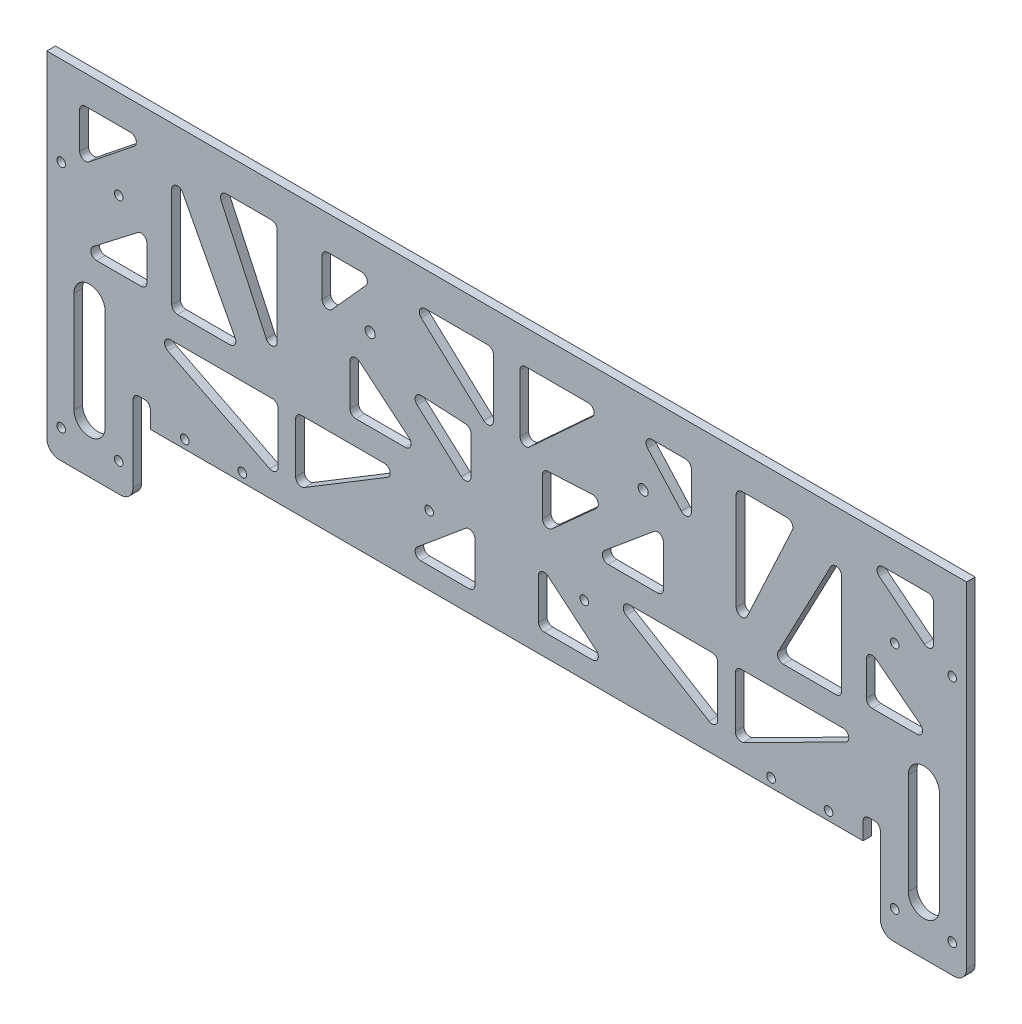
from build123d import *

# Parameters (mm, degrees)
SKETCH_1_W          = 320
SKETCH_1_H          = 91
EXTRUDE_1_DEPTH     = 1.5
SKETCH_2_W          = 30
SKETCH_2_H          = 5
SKETCH_2_W_2        = 248
EXTRUDE_3_DEPTH     = 3
SKETCH_2_4_W        = 6
SKETCH_2_4_H        = 3
CUT_EXTRUDE_1_DEPTH = 3
FILLET_1_R          = 2
SKETCH_3_R          = 1.5
CUT_EXTRUDE_2_DEPTH = 10
SKETCH_4_R          = 1.5
CUT_EXTRUDE_3_DEPTH = 10
EXTRUDE_5_DEPTH     = 3
SKETCH_6_R          = 1.5
CUT_EXTRUDE_4_DEPTH = 10
SKETCH_7_R          = 1.5
CUT_EXTRUDE_5_DEPTH = 10
CUT_EXTRUDE_6_DEPTH = 6.47
CUT_EXTRUDE_7_DEPTH = 10


with BuildPart() as part:
    # 草图1 → 凸台-拉伸1 (new, symmetric)
    with BuildSketch(Plane.XY):
        Rectangle(SKETCH_1_W, SKETCH_1_H)
    extrude(amount=EXTRUDE_1_DEPTH, both=True)

    # 草图2 → 凸台-拉伸3 (add)
    with BuildSketch(Plane.XY.offset(1.5)):
        with Locations((-145, -48)):
            Rectangle(SKETCH_2_W, SKETCH_2_H)
        with Locations((0, -48)):
            Rectangle(SKETCH_2_W_2, SKETCH_2_H)
        with Locations((145, -48)):
            Rectangle(SKETCH_2_W, SKETCH_2_H)
    extrude(amount=-EXTRUDE_3_DEPTH)

    # 草图2<4> → 切除-拉伸1 (cut)
    with BuildSketch(Plane.XY.offset(1.5)):
        with Locations((-127, -44)):
            Rectangle(SKETCH_2_4_W, SKETCH_2_4_H)
        with Locations((127, -44)):
            Rectangle(SKETCH_2_4_W, SKETCH_2_4_H)
    extrude(amount=-CUT_EXTRUDE_1_DEPTH, mode=Mode.SUBTRACT)

    # 圆角1
    fillet_1_edges = [part.edges().sort_by_distance(p)[0] for p in [
        (-124, -42.5, 0),
        (-130, -42.5, 0),
        (124, -42.5, 0),
        (130, -42.5, 0),
    ]]
    fillet(fillet_1_edges, radius=FILLET_1_R)

    # 草图3 → 切除-拉伸2 (cut)
    with BuildSketch(Plane.XY.offset(1.5)):
        with Locations((-91.985927306, -47.5)):
            Circle(SKETCH_3_R)
        with Locations((-111.985927306, -47.5)):
            Circle(SKETCH_3_R)
    cut_extrude_2 = extrude(amount=-CUT_EXTRUDE_2_DEPTH, mode=Mode.SUBTRACT)

    # 镜向1: 切除-拉伸2 across plane
    add(cut_extrude_2.mirror(Plane(origin=(0, 0, 0), x_dir=(0, 0, 1), z_dir=(1, 0, 0))), mode=Mode.SUBTRACT)

    # 草图4 → 切除-拉伸3 (cut)
    with BuildSketch(Plane.XY.offset(1.5)):
        with Locations((-135, 14.5)):
            Circle(SKETCH_4_R)
        with Locations((-155, 14.5)):
            Circle(SKETCH_4_R)
    cut_extrude_3 = extrude(amount=-CUT_EXTRUDE_3_DEPTH, mode=Mode.SUBTRACT)

    # 镜向2: 切除-拉伸3 across plane
    add(cut_extrude_3.mirror(Plane(origin=(0, 0, 0), x_dir=(0, 0, 1), z_dir=(1, 0, 0))), mode=Mode.SUBTRACT)

    # 草图5 → 凸台-拉伸5 (add)
    with BuildSketch(Plane(origin=(0, 0, -1.5), x_dir=(-1, 0, 0), z_dir=(0, 0, -1))):
        with BuildLine():
            Line((134.369849688, -75.5), (155.630150312, -75.5))
            ThreePointArc((155.630150312, -75.5), (158.720100659, -74.220100659), (160, -71.130150312))
            Line((160, -71.130150312), (160, -50.5))
            Line((160, -50.5), (130, -50.5))
            Line((130, -50.5), (130, -71.130150312))
            ThreePointArc((130, -71.130150312), (131.279899341, -74.220100659), (134.369849688, -75.5))
        make_face()
        with BuildLine():
            Line((-155.630150312, -75.5), (-134.369849688, -75.5))
            ThreePointArc((-134.369849688, -75.5), (-131.279899341, -74.220100659), (-130, -71.130150312))
            Line((-130, -71.130150312), (-130, -50.5))
            Line((-130, -50.5), (-160, -50.5))
            Line((-160, -50.5), (-160, -71.130150312))
            ThreePointArc((-160, -71.130150312), (-158.720100659, -74.220100659), (-155.630150312, -75.5))
        make_face()
    extrude(amount=-EXTRUDE_5_DEPTH)

    # 草图6 → 切除-拉伸4 (cut)
    with BuildSketch(Plane(origin=(0, 0, -1.5), x_dir=(-1, 0, 0), z_dir=(0, 0, -1))):
        with Locations((-155, -65.5)):
            Circle(SKETCH_6_R)
        with Locations((-135, -65.5)):
            Circle(SKETCH_6_R)
        with Locations((135, -65.5)):
            Circle(SKETCH_6_R)
        with Locations((155, -65.5)):
            Circle(SKETCH_6_R)
    extrude(amount=-CUT_EXTRUDE_4_DEPTH, mode=Mode.SUBTRACT)

    # 草图7 → 切除-拉伸5 (cut)
    with BuildSketch(Plane(origin=(0, 0, -1.5), x_dir=(-1, 0, 0), z_dir=(0, 0, -1))):
        with Locations((-27, -26.5)):
            Circle(SKETCH_7_R)
        with Locations(Location((27, -26.5, 0), (0, 0, 180))):
            Circle(SKETCH_7_R)
    extrude(amount=-CUT_EXTRUDE_5_DEPTH, mode=Mode.SUBTRACT)

    # 草图8 → 切除-拉伸6 (cut)
    with BuildSketch(Plane(origin=(0, 0, -1.5), x_dir=(-1, 0, 0), z_dir=(0, 0, -1))):
        with BuildLine():
            ThreePointArc((47.5, 18.75), (45.75, 17), (47.5, 15.25))
            ThreePointArc((47.5, 15.25), (49.25, 17), (47.5, 18.75))
        make_face()
        with BuildLine():
            ThreePointArc((-47.5, 15.25), (-45.75, 17), (-47.5, 18.75))
            ThreePointArc((-47.5, 18.75), (-49.25, 17), (-47.5, 15.25))
        make_face()
    extrude(amount=-CUT_EXTRUDE_6_DEPTH, mode=Mode.SUBTRACT)

    # 草图9 → 切除-拉伸7 (cut)
    with BuildSketch(Plane(origin=(0, 0, -1.5), x_dir=(-1, 0, 0), z_dir=(0, 0, -1))):
        with BuildLine():
            Line((-146.571084673, 35.554762953), (-130.871700622, 35.554762953))
            ThreePointArc((-130.871700622, 35.554762953), (-128.984443984, 34.216776836), (-129.622310527, 31.993025334))
            Line((-129.622310527, 31.993025334), (-145.321694578, 19.433518093))
            ThreePointArc((-145.321694578, 19.433518093), (-147.437462134, 19.19264924), (-148.571084673, 20.995255712))
            Line((-148.571084673, 20.995255712), (-148.571084673, 33.554762953))
            ThreePointArc((-148.571084673, 33.554762953), (-147.985298235, 34.968976515), (-146.571084673, 35.554762953))
        make_face()
        with BuildLine():
            Line((-128.393628192, 6.602606323), (-143.939011658, -5.41906906))
            ThreePointArc((-143.939011658, -5.41906906), (-144.608168342, -7.647623246), (-142.715521969, -9.001179354))
            Line((-142.715521969, -9.001179354), (-127.170138504, -9.001179354))
            ThreePointArc((-127.170138504, -9.001179354), (-125.755924941, -8.415392916), (-125.170138504, -7.001179354))
            Line((-125.170138504, -7.001179354), (-125.170138504, 5.020496029))
            ThreePointArc((-125.170138504, 5.020496029), (-126.288940279, 6.815903974), (-128.393628192, 6.602606323))
        make_face()
        with BuildLine():
            Line((-116.54580622, 25.591570419), (-116.54580622, -9.162371518))
            ThreePointArc((-116.54580622, -9.162371518), (-115.960019782, -10.57658508), (-114.54580622, -11.162371518))
            Line((-114.54580622, -11.162371518), (-96.246357519, -11.162371518))
            ThreePointArc((-96.246357519, -11.162371518), (-94.534105239, -10.195905324), (-94.476686903, -8.230563646))
            Line((-94.476686903, -8.230563646), (-112.776135604, 26.52337829))
            ThreePointArc((-112.776135604, 26.52337829), (-115.025732656, 27.53313438), (-116.54580622, 25.591570419))
        make_face()
        with BuildLine():
            Line((-117.928170429, -23.803173571), (-82.444486766, -41.609211763))
            ThreePointArc((-82.444486766, -41.609211763), (-80.497241641, -41.523714393), (-79.547473298, -39.821652858))
            Line((-79.547473298, -39.821652858), (-79.547473298, -22.015614666))
            ThreePointArc((-79.547473298, -22.015614666), (-80.133259735, -20.601401103), (-81.547473298, -20.015614666))
            Line((-81.547473298, -20.015614666), (-117.031156962, -20.015614666))
            ThreePointArc((-117.031156962, -20.015614666), (-118.977322141, -21.554701339), (-117.928170429, -23.803173571))
        make_face()
        with BuildLine():
            Line((-97.576679079, 33.682660292), (-81.852610734, 33.682660292))
            ThreePointArc((-81.852610734, 33.682660292), (-80.438397171, 33.096873854), (-79.852610734, 31.682660292))
            Line((-79.852610734, 31.682660292), (-79.852610734, -2.182107418))
            ThreePointArc((-79.852610734, -2.182107418), (-81.421327301, -4.135052528), (-83.666605335, -3.024380288))
            Line((-83.666605335, -3.024380288), (-99.39067368, 30.840387422))
            ThreePointArc((-99.39067368, 30.840387422), (-99.262583249, 32.758637583), (-97.576679079, 33.682660292))
        make_face()
        with BuildLine():
            Line((-139.72162397, -22.770668499), (-139.72162397, -57.911176268))
            ThreePointArc((-139.72162397, -57.911176268), (-145.144541836, -63.334094134), (-150.567459701, -57.911176268))
            Line((-150.567459701, -57.911176268), (-150.567459701, -22.770668499))
            ThreePointArc((-150.567459701, -22.770668499), (-145.144541836, -17.347750634), (-139.72162397, -22.770668499))
        make_face()
        with BuildLine():
            Line((-73.425907587, -22.015614666), (-73.425907587, -39.51238657))
            ThreePointArc((-73.425907587, -39.51238657), (-72.40747476, -41.254949592), (-70.389381702, -41.222829229))
            Line((-70.389381702, -41.222829229), (-41.516754891, -23.726057325))
            ThreePointArc((-41.516754891, -23.726057325), (-40.627029842, -21.477509341), (-42.553280776, -20.015614666))
            Line((-42.553280776, -20.015614666), (-71.425907587, -20.015614666))
            ThreePointArc((-71.425907587, -20.015614666), (-72.84012115, -20.601401103), (-73.425907587, -22.015614666))
        make_face()
        with BuildLine():
            Line((-62.227699418, 33.682660292), (-50.490166826, 33.682660292))
            ThreePointArc((-50.490166826, 33.682660292), (-48.664048531, 32.498314613), (-49.000685547, 30.347952264))
            Line((-49.000685547, 30.347952264), (-60.738218139, 17.249330923))
            ThreePointArc((-60.738218139, 17.249330923), (-62.942205346, 16.716023619), (-64.227699418, 18.58403895))
            Line((-64.227699418, 18.58403895), (-64.227699418, 31.682660292))
            ThreePointArc((-64.227699418, 31.682660292), (-63.64191298, 33.096873854), (-62.227699418, 33.682660292))
        make_face()
        with BuildLine():
            Line((-28.411729407, 33.682660292), (-6.62180325, 33.682660292))
            ThreePointArc((-6.62180325, 33.682660292), (-5.207589688, 33.096873854), (-4.62180325, 31.682660292))
            Line((-4.62180325, 31.682660292), (-4.62180325, 11.627996381))
            ThreePointArc((-4.62180325, 11.627996381), (-5.818312838, 9.796493403), (-7.976206408, 10.156401298))
            Line((-7.976206408, 10.156401298), (-29.766132564, 30.211065209))
            ThreePointArc((-29.766132564, 30.211065209), (-30.274951101, 32.409574948), (-28.411729407, 33.682660292))
        make_face()
        with BuildLine():
            Line((-51.243944686, 6.360989535), (-33.986546728, -8.023553031))
            ThreePointArc((-33.986546728, -8.023553031), (-33.386589136, -10.240806826), (-35.267092971, -11.559847703))
            Line((-35.267092971, -11.559847703), (-52.524490929, -11.559847703))
            ThreePointArc((-52.524490929, -11.559847703), (-53.938704491, -10.974061266), (-54.524490929, -9.559847703))
            Line((-54.524490929, -9.559847703), (-54.524490929, 4.824694863))
            ThreePointArc((-54.524490929, 4.824694863), (-53.372697129, 6.63592269), (-51.243944686, 6.360989535))
        make_face()
        with BuildLine():
            Line((-14.335164285, -25.505870163), (-31.152486312, -39.526809383))
            ThreePointArc((-31.152486312, -39.526809383), (-31.752232377, -41.744024814), (-29.871766921, -43.062959715))
            Line((-29.871766921, -43.062959715), (-13.054444893, -43.062959715))
            ThreePointArc((-13.054444893, -43.062959715), (-11.640231331, -42.477173277), (-11.054444893, -41.062959715))
            Line((-11.054444893, -41.062959715), (-11.054444893, -27.042020494))
            ThreePointArc((-11.054444893, -27.042020494), (-12.206340767, -25.230744869), (-14.335164285, -25.505870163))
        make_face()
        with BuildLine():
            Line((-29.778139679, 6.787502184), (-14.321584066, 6.012364544))
            ThreePointArc((-14.321584066, 6.012364544), (-12.972559701, 5.393216898), (-12.421757064, 4.014874777))
            Line((-12.421757064, 4.014874777), (-12.421757064, -9.142403992))
            ThreePointArc((-12.421757064, -9.142403992), (-13.608782032, -10.969716663), (-15.760828662, -10.627963569))
            Line((-15.760828662, -10.627963569), (-31.217384274, 3.30445284))
            ThreePointArc((-31.217384274, 3.30445284), (-31.726724324, 5.553801904), (-29.778139679, 6.787502184))
        make_face()
        with BuildLine():
            Line((15.760828662, -10.627963569), (31.217384274, 3.30445284))
            ThreePointArc((31.217384274, 3.30445284), (31.726724324, 5.553801904), (29.778139679, 6.787502184))
            Line((29.778139679, 6.787502184), (14.321584066, 6.012364544))
            ThreePointArc((14.321584066, 6.012364544), (12.972559701, 5.393216898), (12.421757064, 4.014874777))
            Line((12.421757064, 4.014874777), (12.421757064, -9.142403992))
            ThreePointArc((12.421757064, -9.142403992), (13.608782032, -10.969716663), (15.760828662, -10.627963569))
        make_face()
        with BuildLine():
            Line((11.054444893, -41.062959715), (11.054444893, -27.042020494))
            ThreePointArc((11.054444893, -27.042020494), (12.206340767, -25.230744869), (14.335164285, -25.505870163))
            Line((14.335164285, -25.505870163), (31.152486312, -39.526809383))
            ThreePointArc((31.152486312, -39.526809383), (31.752232377, -41.744024814), (29.871766921, -43.062959715))
            Line((29.871766921, -43.062959715), (13.054444893, -43.062959715))
            ThreePointArc((13.054444893, -43.062959715), (11.640231331, -42.477173277), (11.054444893, -41.062959715))
        make_face()
        with BuildLine():
            Line((54.524490929, -9.559847703), (54.524490929, 4.824694863))
            ThreePointArc((54.524490929, 4.824694863), (53.372697129, 6.63592269), (51.243944686, 6.360989535))
            Line((51.243944686, 6.360989535), (33.986546728, -8.023553031))
            ThreePointArc((33.986546728, -8.023553031), (33.386589136, -10.240806826), (35.267092971, -11.559847703))
            Line((35.267092971, -11.559847703), (52.524490929, -11.559847703))
            ThreePointArc((52.524490929, -11.559847703), (53.938704491, -10.974061266), (54.524490929, -9.559847703))
        make_face()
        with BuildLine():
            Line((7.976206408, 10.156401298), (29.766132564, 30.211065209))
            ThreePointArc((29.766132564, 30.211065209), (30.274951101, 32.409574948), (28.411729407, 33.682660292))
            Line((28.411729407, 33.682660292), (6.62180325, 33.682660292))
            ThreePointArc((6.62180325, 33.682660292), (5.207589688, 33.096873854), (4.62180325, 31.682660292))
            Line((4.62180325, 31.682660292), (4.62180325, 11.627996381))
            ThreePointArc((4.62180325, 11.627996381), (5.818312838, 9.796493403), (7.976206408, 10.156401298))
        make_face()
        with BuildLine():
            Line((64.227699418, 18.58403895), (64.227699418, 31.682660292))
            ThreePointArc((64.227699418, 31.682660292), (63.64191298, 33.096873854), (62.227699418, 33.682660292))
            Line((62.227699418, 33.682660292), (50.490166826, 33.682660292))
            ThreePointArc((50.490166826, 33.682660292), (48.664048531, 32.498314613), (49.000685547, 30.347952264))
            Line((49.000685547, 30.347952264), (60.738218139, 17.249330923))
            ThreePointArc((60.738218139, 17.249330923), (62.942205346, 16.716023619), (64.227699418, 18.58403895))
        make_face()
        with BuildLine():
            Line((42.553280776, -20.015614666), (71.425907587, -20.015614666))
            ThreePointArc((71.425907587, -20.015614666), (72.84012115, -20.601401103), (73.425907587, -22.015614666))
            Line((73.425907587, -22.015614666), (73.425907587, -39.51238657))
            ThreePointArc((73.425907587, -39.51238657), (72.40747476, -41.254949592), (70.389381702, -41.222829229))
            Line((70.389381702, -41.222829229), (41.516754891, -23.726057325))
            ThreePointArc((41.516754891, -23.726057325), (40.627029842, -21.477509341), (42.553280776, -20.015614666))
        make_face()
        with BuildLine():
            Line((83.666605335, -3.024380288), (99.39067368, 30.840387422))
            ThreePointArc((99.39067368, 30.840387422), (99.262583249, 32.758637583), (97.576679079, 33.682660292))
            Line((97.576679079, 33.682660292), (81.852610734, 33.682660292))
            ThreePointArc((81.852610734, 33.682660292), (80.438397171, 33.096873854), (79.852610734, 31.682660292))
            Line((79.852610734, 31.682660292), (79.852610734, -2.182107418))
            ThreePointArc((79.852610734, -2.182107418), (81.421327301, -4.135052528), (83.666605335, -3.024380288))
        make_face()
        with BuildLine():
            Line((81.547473298, -20.015614666), (117.031156962, -20.015614666))
            ThreePointArc((117.031156962, -20.015614666), (118.977322141, -21.554701339), (117.928170429, -23.803173571))
            Line((117.928170429, -23.803173571), (82.444486766, -41.609211763))
            ThreePointArc((82.444486766, -41.609211763), (80.497241641, -41.523714393), (79.547473298, -39.821652858))
            Line((79.547473298, -39.821652858), (79.547473298, -22.015614666))
            ThreePointArc((79.547473298, -22.015614666), (80.133259735, -20.601401103), (81.547473298, -20.015614666))
        make_face()
        with BuildLine():
            Line((94.476686903, -8.230563646), (112.776135604, 26.52337829))
            ThreePointArc((112.776135604, 26.52337829), (115.025732656, 27.53313438), (116.54580622, 25.591570419))
            Line((116.54580622, 25.591570419), (116.54580622, -9.162371518))
            ThreePointArc((116.54580622, -9.162371518), (115.960019782, -10.57658508), (114.54580622, -11.162371518))
            Line((114.54580622, -11.162371518), (96.246357519, -11.162371518))
            ThreePointArc((96.246357519, -11.162371518), (94.534105239, -10.195905324), (94.476686903, -8.230563646))
        make_face()
        with BuildLine():
            Line((125.170138504, -7.001179354), (125.170138504, 5.020496029))
            ThreePointArc((125.170138504, 5.020496029), (126.288940279, 6.815903974), (128.393628192, 6.602606323))
            Line((128.393628192, 6.602606323), (143.939011658, -5.41906906))
            ThreePointArc((143.939011658, -5.41906906), (144.608168342, -7.647623246), (142.715521969, -9.001179354))
            Line((142.715521969, -9.001179354), (127.170138504, -9.001179354))
            ThreePointArc((127.170138504, -9.001179354), (125.755924941, -8.415392916), (125.170138504, -7.001179354))
        make_face()
        with BuildLine():
            Line((148.571084673, 20.995255712), (148.571084673, 33.554762953))
            ThreePointArc((148.571084673, 33.554762953), (147.985298235, 34.968976515), (146.571084673, 35.554762953))
            Line((146.571084673, 35.554762953), (130.871700622, 35.554762953))
            ThreePointArc((130.871700622, 35.554762953), (128.984443984, 34.216776836), (129.622310527, 31.993025334))
            Line((129.622310527, 31.993025334), (145.321694578, 19.433518093))
            ThreePointArc((145.321694578, 19.433518093), (147.437462134, 19.19264924), (148.571084673, 20.995255712))
        make_face()
        with BuildLine():
            Line((139.72162397, -22.770668499), (139.72162397, -57.911176268))
            ThreePointArc((139.72162397, -57.911176268), (145.144541836, -63.334094134), (150.567459701, -57.911176268))
            Line((150.567459701, -57.911176268), (150.567459701, -22.770668499))
            ThreePointArc((150.567459701, -22.770668499), (145.144541836, -17.347750634), (139.72162397, -22.770668499))
        make_face()
    extrude(amount=-CUT_EXTRUDE_7_DEPTH, mode=Mode.SUBTRACT)


solid = part.part
